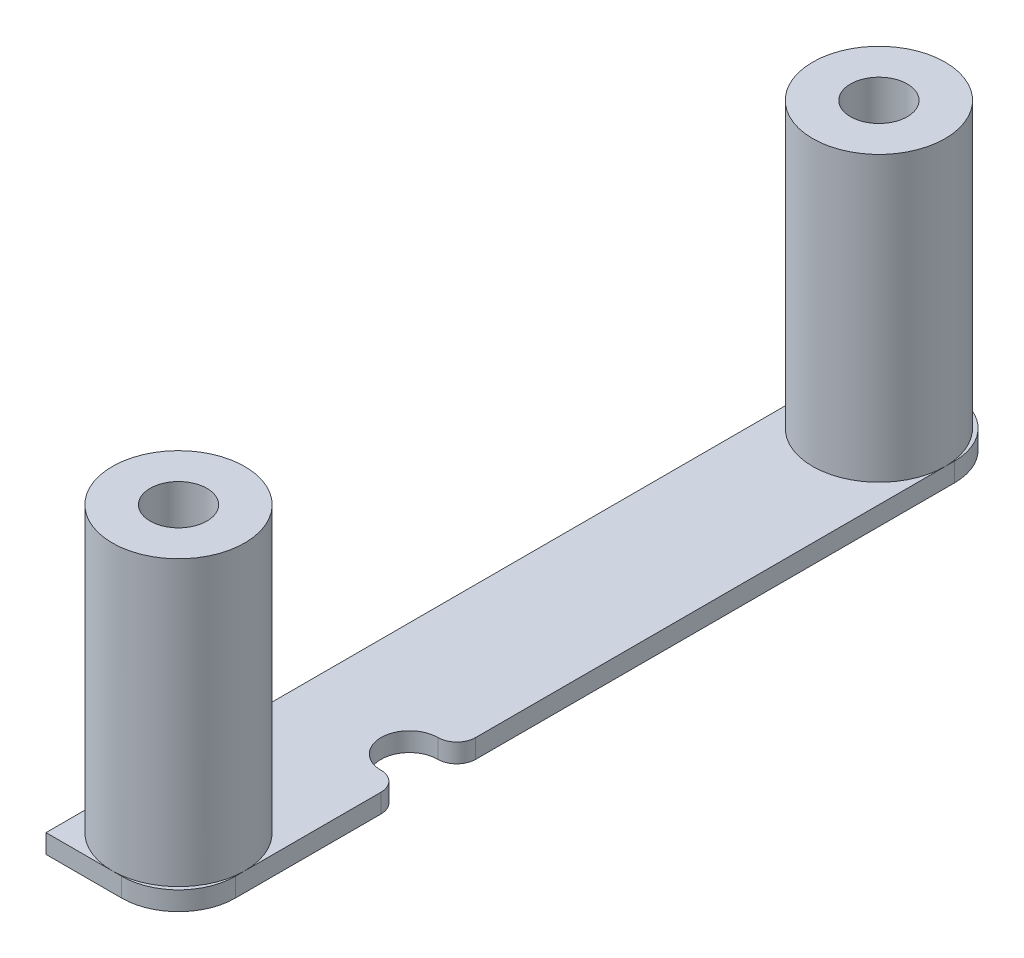
from build123d import *

# Parameters (mm, degrees)
SKETCH1_W               = 44
SKETCH1_H               = 44
BOSS_EXTRUDE1_DEPTH     = 1
SKETCH2_R               = 3.5
BOSS_EXTRUDE2_DEPTH     = 15
SKETCH3_R               = 1.5
CUT_EXTRUDE1_DEPTH      = 15
CUT_EXTRUDE2_DEPTH      = 65.007812023
CUT_EXTRUDE2_DEPTH_BACK = 65.007812023
SKETCH4_W               = 37
SKETCH4_H               = 44
SKETCH5_R               = 1.5
CUT_EXTRUDE3_DEPTH      = 10
FILLET1_R               = 3
FILLET2_R               = 1


with BuildPart() as part:
    # Sketch1 → Boss-Extrude1 (new body)
    with BuildSketch(Plane(origin=(0, 0, 0), x_dir=(1, 0, 0), z_dir=(0, 1, 0))):
        with Locations((22, 22)):
            Rectangle(SKETCH1_W, SKETCH1_H)
    extrude(amount=BOSS_EXTRUDE1_DEPTH)

    # Sketch2 → Boss-Extrude2 (add)
    with BuildSketch(Plane(origin=(0, 1, 0), x_dir=(1, 0, 0), z_dir=(0, 1, 0))):
        with Locations(Location((3.5, 40.5, 0), (0, 0, 90))):
            Circle(SKETCH2_R)
        with Locations(Location((40.5, 40.5, 0), (0, 0, 90))):
            Circle(SKETCH2_R)
        with Locations(Location((40.5, 3.5, 0), (0, 0, 270))):
            Circle(SKETCH2_R)
        with Locations(Location((3.5, 3.5, 0), (0, 0, 270))):
            Circle(SKETCH2_R)
    extrude(amount=BOSS_EXTRUDE2_DEPTH)

    # Sketch3 → Cut-Extrude1 (cut)
    with BuildSketch(Plane(origin=(0, 16, 0), x_dir=(1, 0, 0), z_dir=(0, 1, 0))):
        with Locations(Location((3.5, 40.5, 0), (0, 0, 270))):
            Circle(SKETCH3_R)
        with Locations(Location((40.5, 40.5, 0), (0, 0, 270))):
            Circle(SKETCH3_R)
        with Locations(Location((40.5, 3.5, 0), (0, 0, 270))):
            Circle(SKETCH3_R)
        with Locations(Location((3.5, 3.5, 0), (0, 0, 270))):
            Circle(SKETCH3_R)
    extrude(amount=-CUT_EXTRUDE1_DEPTH, mode=Mode.SUBTRACT)

    # Sketch4 → Cut-Extrude2 (cut, two sides: drawn at the far end of the back side and taken through both)
    with BuildSketch(Plane(origin=(0, 1, 0), x_dir=(1, 0, 0), z_dir=(0, 1, 0)).offset(-CUT_EXTRUDE2_DEPTH_BACK)):
        with Locations((25.5, 22)):
            Rectangle(SKETCH4_W, SKETCH4_H)
    extrude(amount=CUT_EXTRUDE2_DEPTH + CUT_EXTRUDE2_DEPTH_BACK, mode=Mode.SUBTRACT)

    # Sketch5 → Cut-Extrude3 (cut)
    with BuildSketch(Plane(origin=(0, 1, 0), x_dir=(1, 0, 0), z_dir=(0, 1, 0))):
        with Locations((6, 13.2)):
            Circle(SKETCH5_R)
    extrude(amount=-CUT_EXTRUDE3_DEPTH, mode=Mode.SUBTRACT)

    # Fillet1
    fillet1_edges = [part.edges().sort_by_distance(p)[0] for p in [
        (7, 0.5, -44),
        (7, 0.5, 0),
    ]]
    fillet(fillet1_edges, radius=FILLET1_R)

    # Fillet2
    fillet2_edges = [part.edges().sort_by_distance(p)[0] for p in [
        (7, 0.5, -14.318033989),
        (7, 0.5, -12.081966011),
    ]]
    fillet(fillet2_edges, radius=FILLET2_R)


solid = part.part
